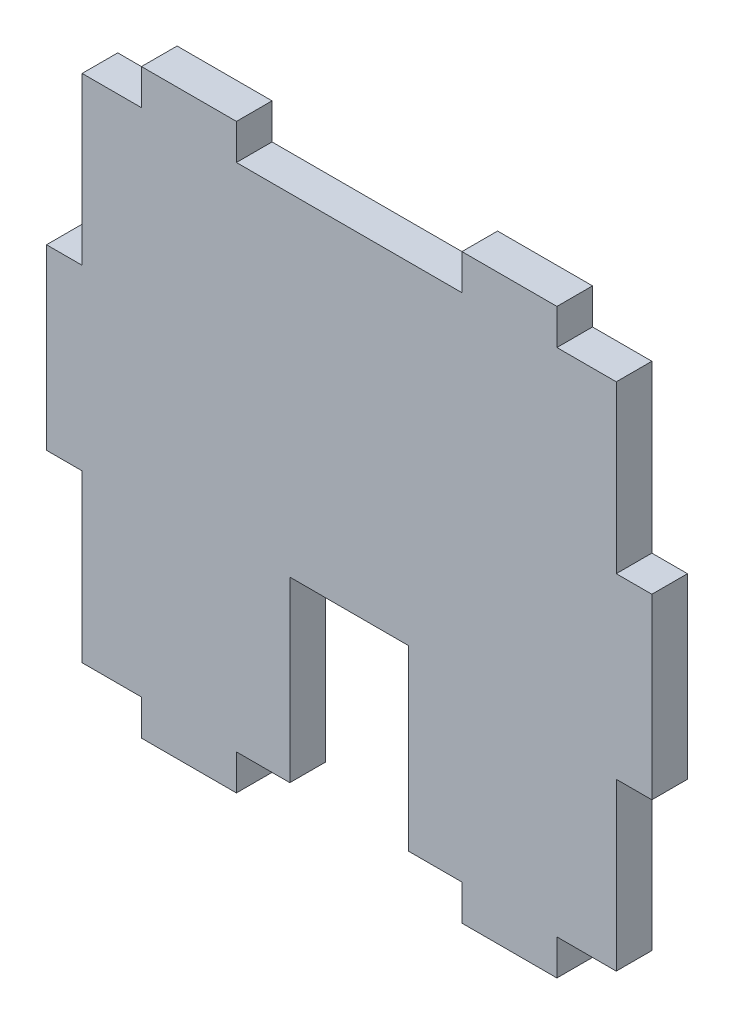
from build123d import *

# Parameters (mm, degrees)
SKETCH_1_W          = 45
SKETCH_1_H          = 43
SKETCH_1_W_2        = 8
SKETCH_1_H_2        = 3
SKETCH_1_W_3        = 3
SKETCH_1_H_3        = 15
EXTRUDE_1_DEPTH     = 3
SKETCH_2_W          = 10
SKETCH_2_H          = 15
CUT_EXTRUDE_1_DEPTH = 10


with BuildPart() as part:
    # 草图1 → 凸台-拉伸1 (new body)
    with BuildSketch(Plane.XY):
        Rectangle(SKETCH_1_W, SKETCH_1_H)
        with Locations((-13.5, 23)):
            Rectangle(SKETCH_1_W_2, SKETCH_1_H_2)
        with Locations((13.5, 23)):
            Rectangle(SKETCH_1_W_2, SKETCH_1_H_2)
        with Locations((-24, 0)):
            Rectangle(SKETCH_1_W_3, SKETCH_1_H_3)
        with Locations((24, 0)):
            Rectangle(SKETCH_1_W_3, SKETCH_1_H_3)
        with Locations((-13.5, -23)):
            Rectangle(SKETCH_1_W_2, SKETCH_1_H_2)
        with Locations((13.5, -23)):
            Rectangle(SKETCH_1_W_2, SKETCH_1_H_2)
    extrude(amount=EXTRUDE_1_DEPTH)

    # 草图2 → 切除-拉伸1 (cut)
    with BuildSketch(Plane.XY.offset(3)):
        with Locations((0, -14)):
            Rectangle(SKETCH_2_W, SKETCH_2_H)
    extrude(amount=-CUT_EXTRUDE_1_DEPTH, mode=Mode.SUBTRACT)


solid = part.part
